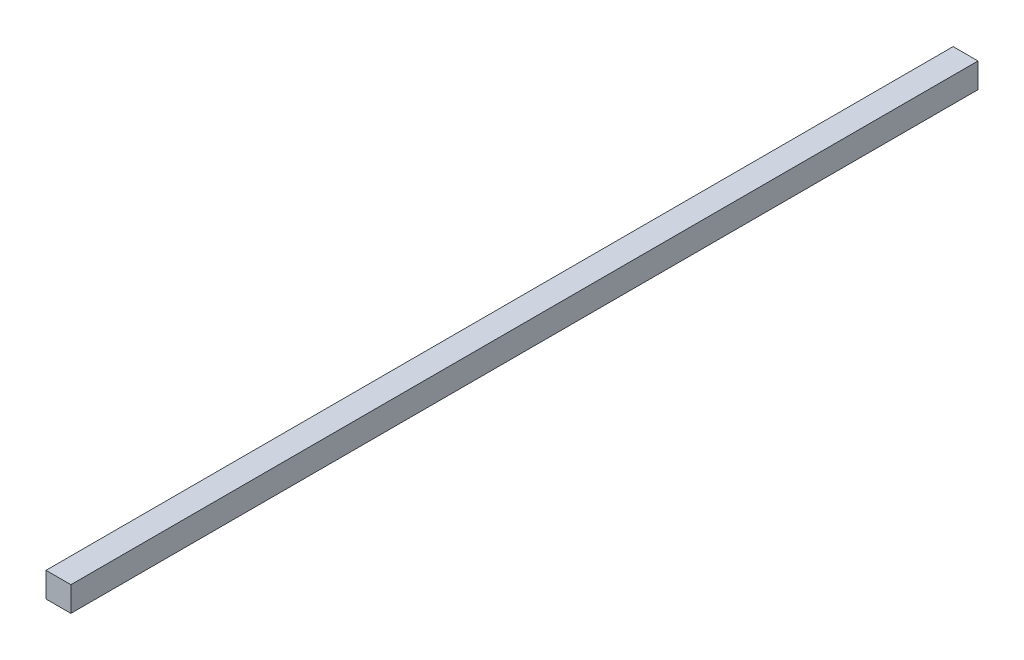
from build123d import *

# Parameters (mm, degrees)
SKETCH1_W           = 10
SKETCH1_H           = 10
BOSS_EXTRUDE1_DEPTH = 364.6


with BuildPart() as part:
    # Sketch1 → Boss-Extrude1 (new body)
    with BuildSketch(Plane.XY):
        Rectangle(SKETCH1_W, SKETCH1_H)
    extrude(amount=BOSS_EXTRUDE1_DEPTH)


solid = part.part
